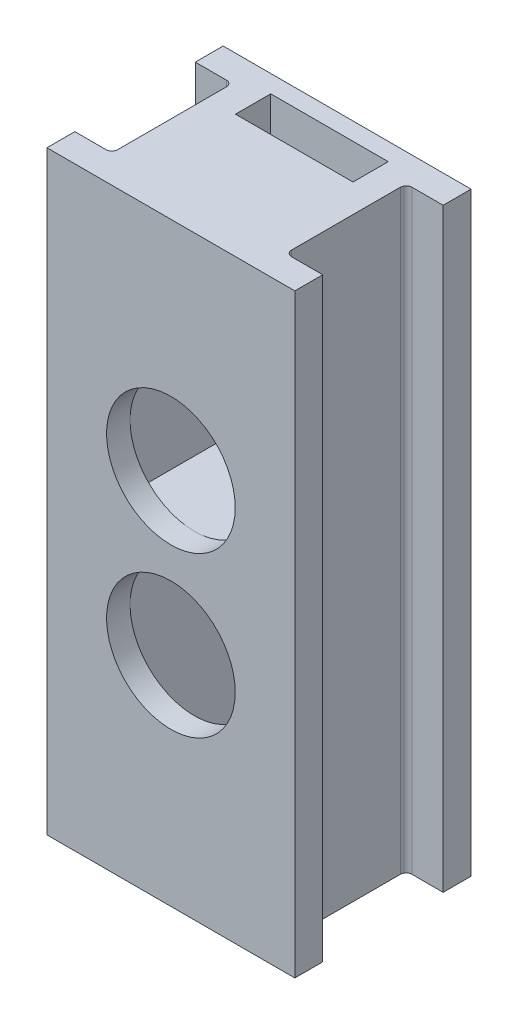
from build123d import *

# Parameters (mm, degrees)
SKETCH2_W               = 21.1
SKETCH2_H               = 50.65
SKETCH2_R               = 5.475
BOSS_EXTRUDE1_DEPTH     = 7.5
SKETCH3_W               = 3.15
SKETCH3_H               = 10.25
CUT_EXTRUDE1_DEPTH      = 53.277863384
SKETCH4_W               = 11.1
SKETCH4_H               = 21
CUT_EXTRUDE2_DEPTH      = 13
FILLET1_R               = 0.5
CUT_EXTRUDE3_DEPTH      = 53.277863384
CUT_EXTRUDE3_DEPTH_BACK = 24
SKETCH6_W               = 10
SKETCH6_H               = 3
CUT_EXTRUDE4_START      = -50.65
SKETCH6_2_W             = 10
SKETCH6_2_H             = 3
CUT_EXTRUDE4_DEPTH      = 24
SKETCH7_W               = 11.1
SKETCH7_H               = 5
CUT_EXTRUDE5_DEPTH      = 1


with BuildPart() as part:
    # Sketch2 → Boss-Extrude1 (new, symmetric)
    with BuildSketch(Plane.XY):
        with Locations((0, 6.8)):
            Rectangle(SKETCH2_W, SKETCH2_H)
        Circle(SKETCH2_R, mode=Mode.SUBTRACT)
        with Locations((0, 13.6)):
            Circle(SKETCH2_R, mode=Mode.SUBTRACT)
    extrude(amount=BOSS_EXTRUDE1_DEPTH, both=True)

    # Sketch3 → Cut-Extrude1 (cut, symmetric)
    with BuildSketch(Plane(origin=(0, 32.125, 0), x_dir=(1, 0, 0), z_dir=(0, 1, 0))):
        with Locations((-8.975, 0)):
            Rectangle(SKETCH3_W, SKETCH3_H)
    cut_extrude1 = extrude(amount=CUT_EXTRUDE1_DEPTH, both=True, mode=Mode.SUBTRACT)

    # Mirror1: Cut-Extrude1 across plane
    add(cut_extrude1.mirror(Plane(origin=(0, 0, 0), x_dir=(0, 0, 1), z_dir=(1, 0, 0))), mode=Mode.SUBTRACT)

    # Sketch4 → Cut-Extrude2 (cut)
    with BuildSketch(Plane(origin=(0, 0, -7.5), x_dir=(-1, 0, 0), z_dir=(0, 0, -1))):
        with Locations((0, -5.025)):
            Rectangle(SKETCH4_W, SKETCH4_H)
        with Locations((0, 18.625)):
            Rectangle(SKETCH4_W, SKETCH4_H)
    extrude(amount=-CUT_EXTRUDE2_DEPTH, mode=Mode.SUBTRACT)

    # Fillet1
    fillet1_edges = [part.edges().sort_by_distance(p)[0] for p in [
        (-7.4, 6.8, -5.125),
        (-7.4, 6.8, 5.125),
        (7.4, 6.8, 5.125),
        (7.4, 6.8, -5.125),
    ]]
    fillet(fillet1_edges, radius=FILLET1_R)

    # Sketch6 → Cut-Extrude3 (cut, two sides: drawn at the far end of the back side and taken through both)
    with BuildSketch(Plane(origin=(0, 32.125, 0), x_dir=(1, 0, 0), z_dir=(0, 1, 0)).offset(-CUT_EXTRUDE3_DEPTH_BACK)):
        with Locations((0, 4.5)):
            Rectangle(SKETCH6_W, SKETCH6_H)
    extrude(amount=CUT_EXTRUDE3_DEPTH + CUT_EXTRUDE3_DEPTH_BACK, mode=Mode.SUBTRACT)

    # Sketch6<2> → Cut-Extrude4 (cut)
    with BuildSketch(Plane(origin=(0, 32.125, 0), x_dir=(1, 0, 0), z_dir=(0, 1, 0)).offset(CUT_EXTRUDE4_START)):
        with Locations((0, 4.5)):
            Rectangle(SKETCH6_2_W, SKETCH6_2_H)
    extrude(amount=CUT_EXTRUDE4_DEPTH, mode=Mode.SUBTRACT)

    # Sketch7 → Cut-Extrude5 (cut)
    with BuildSketch(Plane(origin=(0, 0, 5.5), x_dir=(-1, 0, 0), z_dir=(0, 0, -1))):
        with Locations((0, 26.625)):
            Rectangle(SKETCH7_W, SKETCH7_H)
        with Locations((0, -13.025)):
            Rectangle(SKETCH7_W, SKETCH7_H)
    extrude(amount=-CUT_EXTRUDE5_DEPTH, mode=Mode.SUBTRACT)


solid = part.part
